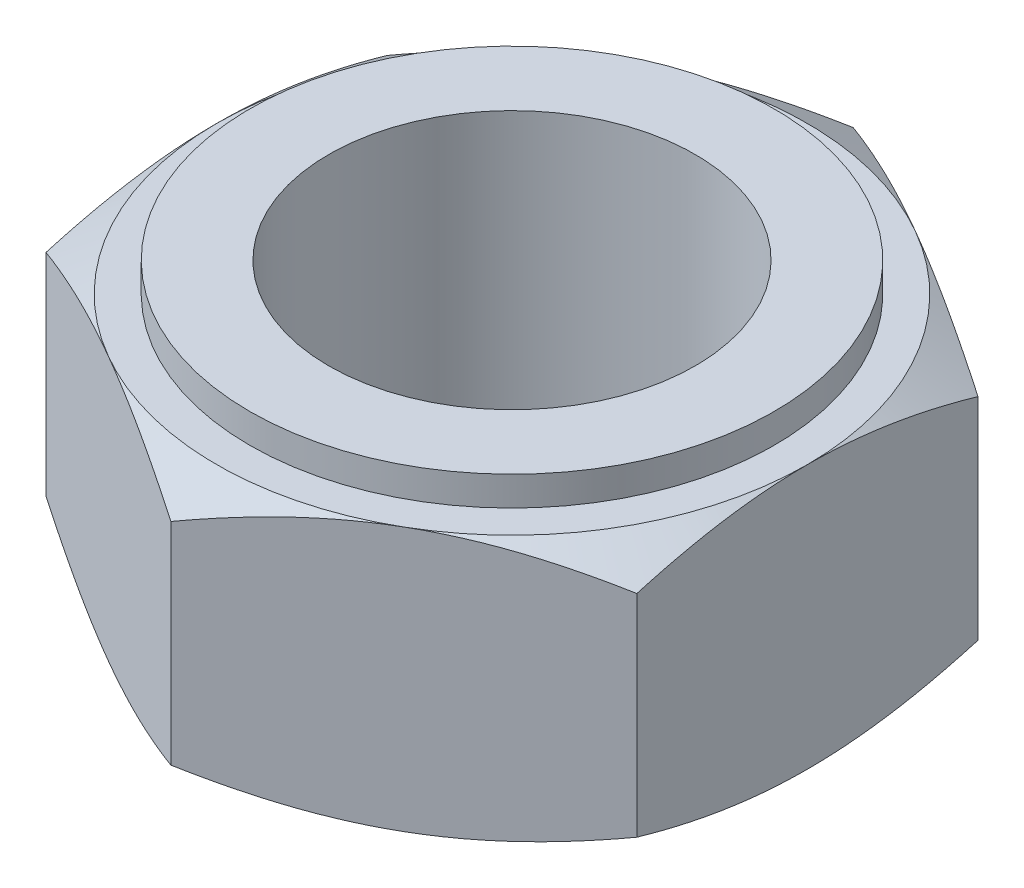
from build123d import *

# Parameters (mm, degrees)
SKETCH1_R               = 4
BOSS_EXTRUDE1_DEPTH     = 3.2
SKETCH9_OUTSIDE_W       = 19.044
SKETCH9_OUTSIDE_H       = 21.04
SKETCH9_OUTSIDE_R       = 5.723909236
CUT_EXTRUDE3_DEPTH      = 0.64
SKETCH5_OUTSIDE_W       = 62.042
SKETCH5_OUTSIDE_H       = 64.038
SKETCH5_OUTSIDE_R       = 6.45
CUT_EXTRUDE2_DEPTH      = 12.412716592
CUT_EXTRUDE2_DRAFT      = -60
MIRROR1_COPY_1_SKETCH_W = 62.042
MIRROR1_COPY_1_SKETCH_H = 64.038
MIRROR1_COPY_1_SKETCH_R = 6.45
MIRROR1_COPY_1_DEPTH    = 12.412716592
MIRROR1_COPY_1_DRAFT    = -60


with BuildPart() as part:
    # Sketch1 → Boss-Extrude1 (new, symmetric)
    with BuildSketch(Plane(origin=(0, 0, 0), x_dir=(1, 0, 0), z_dir=(0, 1, 0))):
        Polygon((-6.45, 3.723909236), (-6.45, -3.723909236), (0, -7.447818473), (6.45, -3.723909236), (6.45, 3.723909236), (0, 7.447818473), align=None)
        with Locations(Location((0, 0, 0), (0, 0, 270))):
            Circle(SKETCH1_R, mode=Mode.SUBTRACT)
    extrude(amount=BOSS_EXTRUDE1_DEPTH, both=True)

    # Sketch9 outside → Cut-Extrude3 (cut)
    with BuildSketch(Plane(origin=(0, 3.2, 0), x_dir=(1, 0, 0), z_dir=(0, 1, 0))):
        Rectangle(SKETCH9_OUTSIDE_W, SKETCH9_OUTSIDE_H)
        with Locations(Location((0, 0, 0), (0, 0, 270))):
            Circle(SKETCH9_OUTSIDE_R, mode=Mode.SUBTRACT)
    extrude(amount=-CUT_EXTRUDE3_DEPTH, mode=Mode.SUBTRACT)


with BuildPart() as cut_extrude2_tool:
    # Sketch5 outside → Cut-Extrude2 (with draft: the straight prism first)
    with BuildSketch(Plane(origin=(0, 2.56, 0), x_dir=(1, 0, 0), z_dir=(0, 1, 0))):
        Rectangle(SKETCH5_OUTSIDE_W, SKETCH5_OUTSIDE_H)
        Circle(SKETCH5_OUTSIDE_R, mode=Mode.SUBTRACT)
    extrude(amount=-CUT_EXTRUDE2_DEPTH)
    # Cut-Extrude2: the draft: its side faces are tilted about the plane it starts from
    cut_extrude2_sides = [cut_extrude2_tool.faces().sort_by_distance(p)[0] for p in [
        (0, -3.646358296, 32.019),
        (31.021, -3.646358296, 0),
        (0, -3.646358296, -32.019),
        (-31.021, -3.646358296, 0),
        (-6.45, -3.646358296, 0),
    ]]
    draft(cut_extrude2_sides, Plane(origin=(0, 2.56, 0), x_dir=(1, 0, 0), z_dir=(0, 1, 0)), CUT_EXTRUDE2_DRAFT)


with BuildPart() as part_1:
    add(part.part)

    # Cut-Extrude2: cut by cut_extrude2_tool
    add(cut_extrude2_tool.part, mode=Mode.SUBTRACT)


with BuildPart() as mirror1_copy_1_tool:
    # Mirror1 copy 1 sketch → Mirror1 copy 1 (with draft: the straight prism first)
    with BuildSketch(Plane.XZ.offset(3.2)):
        Rectangle(MIRROR1_COPY_1_SKETCH_W, MIRROR1_COPY_1_SKETCH_H)
        Circle(MIRROR1_COPY_1_SKETCH_R, mode=Mode.SUBTRACT)
    extrude(amount=-MIRROR1_COPY_1_DEPTH)
    # Mirror1 copy 1: the draft: its side faces are tilted about the plane it starts from
    mirror1_copy_1_sides = [mirror1_copy_1_tool.faces().sort_by_distance(p)[0] for p in [
        (0, 3.006358296, 32.019),
        (31.021, 3.006358296, 0),
        (0, 3.006358296, -32.019),
        (-31.021, 3.006358296, 0),
        (-6.45, 3.006358296, 0),
    ]]
    draft(mirror1_copy_1_sides, Plane.XZ.offset(3.2), MIRROR1_COPY_1_DRAFT)


with BuildPart() as part_2:
    add(part_1.part)

    # Mirror1 copy 1: cut by mirror1_copy_1_tool
    add(mirror1_copy_1_tool.part, mode=Mode.SUBTRACT)


solid = part_2.part
